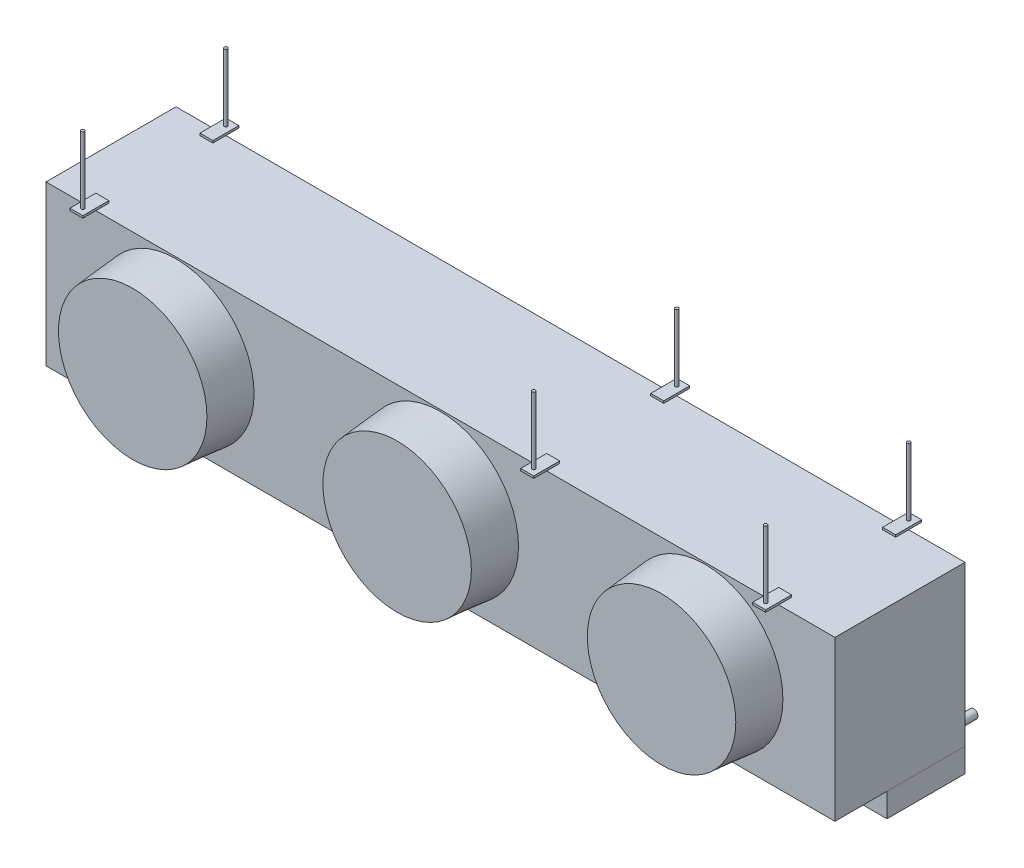
from build123d import *

# Parameters (mm, degrees)
SKETCH1_W                     = 2311.4
SKETCH1_H                     = 381
BOSS_EXTRUDE1_DEPTH           = 466.725
SKETCH2_R                     = 228.6
BOSS_EXTRUDE2_DEPTH           = 127
BOSS_EXTRUDE2_DRAFT           = 5
BOSS_EXTRUDE2_PROFILE_2_DEPTH = 127
BOSS_EXTRUDE2_PROFILE_2_DRAFT = 5
BOSS_EXTRUDE2_PROFILE_3_DEPTH = 127
BOSS_EXTRUDE2_PROFILE_3_DRAFT = 5
SKETCH3_W                     = 38.1
SKETCH3_H                     = 76.2
SKETCH3_R                     = 4.7625
BOSS_EXTRUDE3_DEPTH           = 6.35
SKETCH4_R                     = 4.7625
BOSS_EXTRUDE4_DEPTH           = 203.2
BOSS_EXTRUDE4_2_DEPTH         = 203.2
BOSS_EXTRUDE4_3_DEPTH         = 203.2
BOSS_EXTRUDE4_4_DEPTH         = 203.2
BOSS_EXTRUDE4_5_DEPTH         = 203.2
BOSS_EXTRUDE4_6_DEPTH         = 203.2
SKETCH5_W                     = 2311.4
SKETCH5_H                     = 228.6
BOSS_EXTRUDE5_DEPTH           = 69.85
SKETCH6_R                     = 12.7
SKETCH6_R_2                   = 11.1125
BOSS_EXTRUDE6_DEPTH           = 44.45
SKETCH7_R                     = 12.7
BOSS_EXTRUDE7_DEPTH           = 76.2


with BuildPart() as part:
    # Sketch1 → Boss-Extrude1 (new body)
    with BuildSketch(Plane(origin=(0, 0, 0), x_dir=(1, 0, 0), z_dir=(0, 1, 0))):
        Rectangle(SKETCH1_W, SKETCH1_H)
    extrude(amount=BOSS_EXTRUDE1_DEPTH)


with BuildPart() as boss_extrude2_tool:
    # Sketch2 → Boss-Extrude2 (with draft: the straight prism first)
    with BuildSketch(Plane.XY.offset(190.5)):
        with Locations((0, 233.3625)):
            Circle(SKETCH2_R)
    extrude(amount=BOSS_EXTRUDE2_DEPTH)
    # Boss-Extrude2: the draft: its side faces are tilted about the plane it starts from
    boss_extrude2_sides = [boss_extrude2_tool.faces().sort_by_distance(p)[0] for p in [
        (-228.6, 233.3625, 254),
    ]]
    draft(boss_extrude2_sides, Plane.XY.offset(190.5), BOSS_EXTRUDE2_DRAFT)


with BuildPart() as part_1:
    add(part.part)

    # Boss-Extrude2: add boss_extrude2_tool
    add(boss_extrude2_tool.part)


with BuildPart() as boss_extrude2_profile_2_tool:
    # Sketch2 → Boss-Extrude2 profile 2 (with draft: the straight prism first)
    with BuildSketch(Plane.XY.offset(190.5)):
        with Locations((774.7, 233.3625)):
            Circle(SKETCH2_R)
    extrude(amount=BOSS_EXTRUDE2_PROFILE_2_DEPTH)
    # Boss-Extrude2 profile 2: the draft: its side faces are tilted about the plane it starts from
    boss_extrude2_profile_2_sides = [boss_extrude2_profile_2_tool.faces().sort_by_distance(p)[0] for p in [
        (546.1, 233.3625, 254),
    ]]
    draft(boss_extrude2_profile_2_sides, Plane.XY.offset(190.5), BOSS_EXTRUDE2_PROFILE_2_DRAFT)


with BuildPart() as part_2:
    add(part_1.part)

    # Boss-Extrude2 profile 2: add boss_extrude2_profile_2_tool
    add(boss_extrude2_profile_2_tool.part)


with BuildPart() as boss_extrude2_profile_3_tool:
    # Sketch2 → Boss-Extrude2 profile 3 (with draft: the straight prism first)
    with BuildSketch(Plane.XY.offset(190.5)):
        with Locations((-774.7, 233.3625)):
            Circle(SKETCH2_R)
    extrude(amount=BOSS_EXTRUDE2_PROFILE_3_DEPTH)
    # Boss-Extrude2 profile 3: the draft: its side faces are tilted about the plane it starts from
    boss_extrude2_profile_3_sides = [boss_extrude2_profile_3_tool.faces().sort_by_distance(p)[0] for p in [
        (-1003.3, 233.3625, 254),
    ]]
    draft(boss_extrude2_profile_3_sides, Plane.XY.offset(190.5), BOSS_EXTRUDE2_PROFILE_3_DRAFT)


with BuildPart() as part_3:
    add(part_2.part)

    # Boss-Extrude2 profile 3: add boss_extrude2_profile_3_tool
    add(boss_extrude2_profile_3_tool.part)

    # Sketch3 → Boss-Extrude3 (add)
    # profile 1 of 6: a face of its own
    with BuildSketch(Plane(origin=(0, 466.725, 0), x_dir=(1, 0, 0), z_dir=(0, 1, 0))):
        with Locations((292.1, 190.5)):
            Rectangle(SKETCH3_W, SKETCH3_H)
        with Locations(Location((292.1, 209.55, 0), (0, 0, 270))):
            Circle(SKETCH3_R, mode=Mode.SUBTRACT)
    # profile 2 of 6: a face of its own
    with BuildSketch(Plane(origin=(0, 466.725, 0), x_dir=(1, 0, 0), z_dir=(0, 1, 0))):
        with Locations((292.1, -190.5)):
            Rectangle(SKETCH3_W, SKETCH3_H)
        with Locations(Location((292.1, -209.55, 0), (0, 0, 270))):
            Circle(SKETCH3_R, mode=Mode.SUBTRACT)
    # profile 3 of 6: a face of its own
    with BuildSketch(Plane(origin=(0, 466.725, 0), x_dir=(1, 0, 0), z_dir=(0, 1, 0))):
        with Locations((971.55, 190.5)):
            Rectangle(SKETCH3_W, SKETCH3_H)
        with Locations(Location((971.55, 209.55, 0), (0, 0, 270))):
            Circle(SKETCH3_R, mode=Mode.SUBTRACT)
    # profile 4 of 6: a face of its own
    with BuildSketch(Plane(origin=(0, 466.725, 0), x_dir=(1, 0, 0), z_dir=(0, 1, 0))):
        with Locations((971.55, -190.5)):
            Rectangle(SKETCH3_W, SKETCH3_H)
        with Locations(Location((971.55, -209.55, 0), (0, 0, 270))):
            Circle(SKETCH3_R, mode=Mode.SUBTRACT)
    # profile 5 of 6: a face of its own
    with BuildSketch(Plane(origin=(0, 466.725, 0), x_dir=(1, 0, 0), z_dir=(0, 1, 0))):
        with Locations((-1028.7, 190.5)):
            Rectangle(SKETCH3_W, SKETCH3_H)
        with Locations(Location((-1028.7, 209.55, 0), (0, 0, 270))):
            Circle(SKETCH3_R, mode=Mode.SUBTRACT)
    # profile 6 of 6: a face of its own
    with BuildSketch(Plane(origin=(0, 466.725, 0), x_dir=(1, 0, 0), z_dir=(0, 1, 0))):
        with Locations((-1028.7, -190.5)):
            Rectangle(SKETCH3_W, SKETCH3_H)
        with Locations(Location((-1028.7, -209.55, 0), (0, 0, 270))):
            Circle(SKETCH3_R, mode=Mode.SUBTRACT)
    extrude(amount=BOSS_EXTRUDE3_DEPTH)

    # Sketch7 → Boss-Extrude7 (add)
    with BuildSketch(Plane(origin=(0, 0, -190.5), x_dir=(-1, 0, 0), z_dir=(0, 0, -1))):
        with Locations(Location((-1104.9, 19.05, 0), (0, 0, 180))):
            Circle(SKETCH7_R)
        with Locations(Location((1104.9, 19.05, 0), (0, 0, 180))):
            Circle(SKETCH7_R)
    extrude(amount=BOSS_EXTRUDE7_DEPTH)


with BuildPart() as body_2:
    # Sketch4 → Boss-Extrude4 (new body)
    with BuildSketch(Plane(origin=(0, 466.725, 0), x_dir=(1, 0, 0), z_dir=(0, 1, 0))):
        with Locations(Location((-1028.7, 209.55, 0), (0, 0, 270))):
            Circle(SKETCH4_R)
    extrude(amount=BOSS_EXTRUDE4_DEPTH)


with BuildPart() as body_3:
    # Sketch4 → Boss-Extrude4 2 (new body)
    with BuildSketch(Plane(origin=(0, 466.725, 0), x_dir=(1, 0, 0), z_dir=(0, 1, 0))):
        with Locations(Location((-1028.7, -209.55, 0), (0, 0, 270))):
            Circle(SKETCH4_R)
    extrude(amount=BOSS_EXTRUDE4_2_DEPTH)


with BuildPart() as body_4:
    # Sketch4 → Boss-Extrude4 3 (new body)
    with BuildSketch(Plane(origin=(0, 466.725, 0), x_dir=(1, 0, 0), z_dir=(0, 1, 0))):
        with Locations(Location((292.1, -209.55, 0), (0, 0, 270))):
            Circle(SKETCH4_R)
    extrude(amount=BOSS_EXTRUDE4_3_DEPTH)


with BuildPart() as body_5:
    # Sketch4 → Boss-Extrude4 4 (new body)
    with BuildSketch(Plane(origin=(0, 466.725, 0), x_dir=(1, 0, 0), z_dir=(0, 1, 0))):
        with Locations(Location((292.1, 209.55, 0), (0, 0, 270))):
            Circle(SKETCH4_R)
    extrude(amount=BOSS_EXTRUDE4_4_DEPTH)


with BuildPart() as body_6:
    # Sketch4 → Boss-Extrude4 5 (new body)
    with BuildSketch(Plane(origin=(0, 466.725, 0), x_dir=(1, 0, 0), z_dir=(0, 1, 0))):
        with Locations(Location((971.55, 209.55, 0), (0, 0, 270))):
            Circle(SKETCH4_R)
    extrude(amount=BOSS_EXTRUDE4_5_DEPTH)


with BuildPart() as body_7:
    # Sketch4 → Boss-Extrude4 6 (new body)
    with BuildSketch(Plane(origin=(0, 466.725, 0), x_dir=(1, 0, 0), z_dir=(0, 1, 0))):
        with Locations(Location((971.55, -209.55, 0), (0, 0, 270))):
            Circle(SKETCH4_R)
    extrude(amount=BOSS_EXTRUDE4_6_DEPTH)


with BuildPart() as body_8:
    # Sketch5 → Boss-Extrude5 (new body)
    with BuildSketch(Plane.XZ):
        with Locations((0, -76.2)):
            Rectangle(SKETCH5_W, SKETCH5_H)
    extrude(amount=BOSS_EXTRUDE5_DEPTH)

    # Sketch6 → Boss-Extrude6 (add)
    with BuildSketch(Plane.XZ.offset(69.85)):
        with Locations(Location((0, -76.2, 0), (0, 0, 270))):
            Circle(SKETCH6_R)
        with Locations(Location((0, -76.2, 0), (0, 0, 270))):
            Circle(SKETCH6_R_2, mode=Mode.SUBTRACT)
    extrude(amount=BOSS_EXTRUDE6_DEPTH)


solid = Compound([part_3.part, body_2.part, body_3.part, body_4.part, body_5.part, body_6.part, body_7.part, body_8.part])
